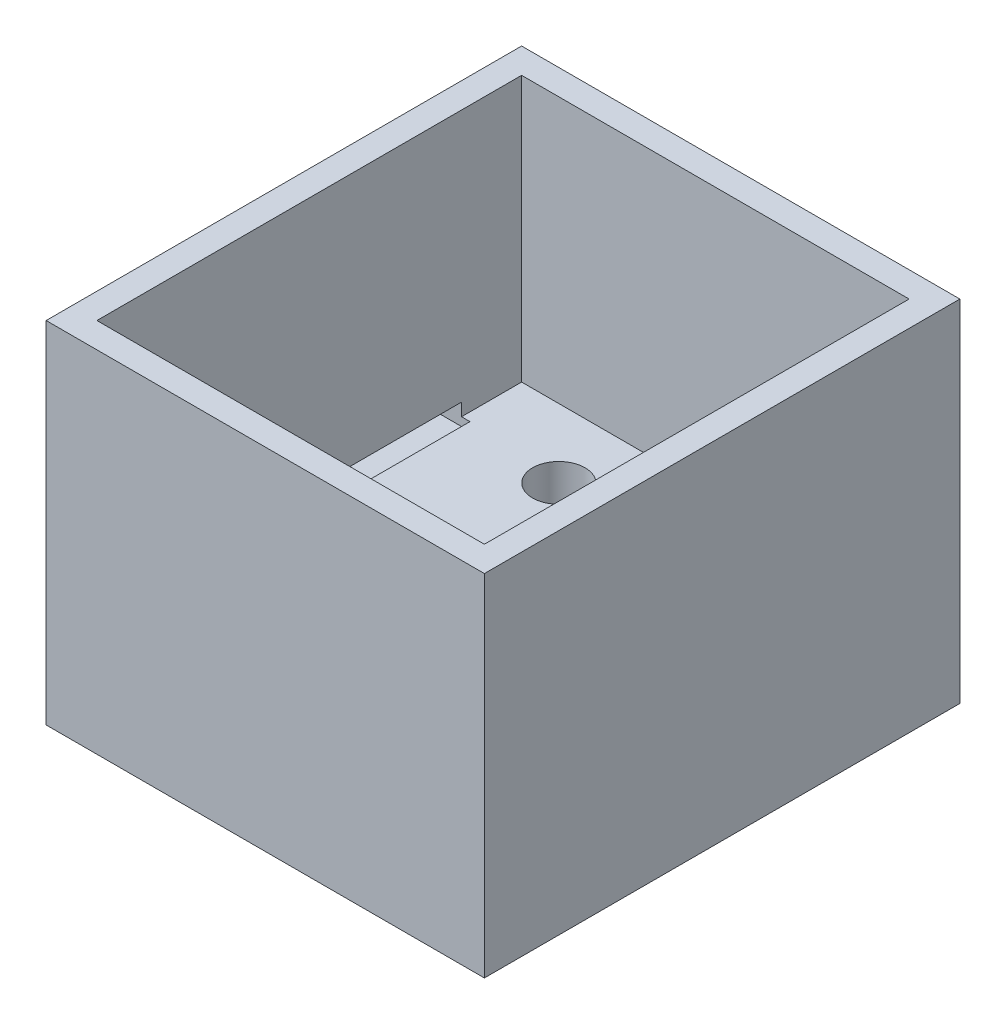
from build123d import *

# Parameters (mm, degrees)
SKETCH1_R           = 1.55
BOSS_EXTRUDE1_DEPTH = 5
SKETCH2_W           = 25.9
SKETCH2_H           = 28.1
SKETCH2_W_2         = 22.9
SKETCH2_H_2         = 25.1
BOSS_EXTRUDE2_DEPTH = 15.7
CUT_EXTRUDE1_DEPTH  = 2


with BuildPart() as part:
    # Sketch1 → Boss-Extrude1 (new body)
    with BuildSketch(Plane(origin=(0, 0, 0), x_dir=(1, 0, 0), z_dir=(0, 1, 0))):
        Polygon((0, 25.1), (-3, 25.1), (-3, -3), (22.9, -3), (22.9, 25.1), align=None)
        with Locations(Location((17.36, 2.54, 0), (0, 0, 270))):
            Circle(SKETCH1_R, mode=Mode.SUBTRACT)
        with Locations(Location((4.76, 19.54, 0), (0, 0, 270))):
            Circle(SKETCH1_R, mode=Mode.SUBTRACT)
    extrude(amount=BOSS_EXTRUDE1_DEPTH)

    # Sketch2 → Boss-Extrude2 (add)
    with BuildSketch(Plane(origin=(0, 5, 0), x_dir=(1, 0, 0), z_dir=(0, 1, 0))):
        with Locations((9.95, 11.05)):
            Rectangle(SKETCH2_W, SKETCH2_H)
        with Locations((9.95, 11.05)):
            Rectangle(SKETCH2_W_2, SKETCH2_H_2, mode=Mode.SUBTRACT)
    extrude(amount=BOSS_EXTRUDE2_DEPTH)

    # Sketch3 → Cut-Extrude1 (cut)
    with BuildSketch(Plane.ZY.offset(3)):
        Polygon((-11.05, 4.5), (-20.05, 4.5), (-20.05, 5.75), (-2.05, 5.75), (-2.05, 4.5), align=None)
    extrude(amount=-CUT_EXTRUDE1_DEPTH, mode=Mode.SUBTRACT)


solid = part.part
